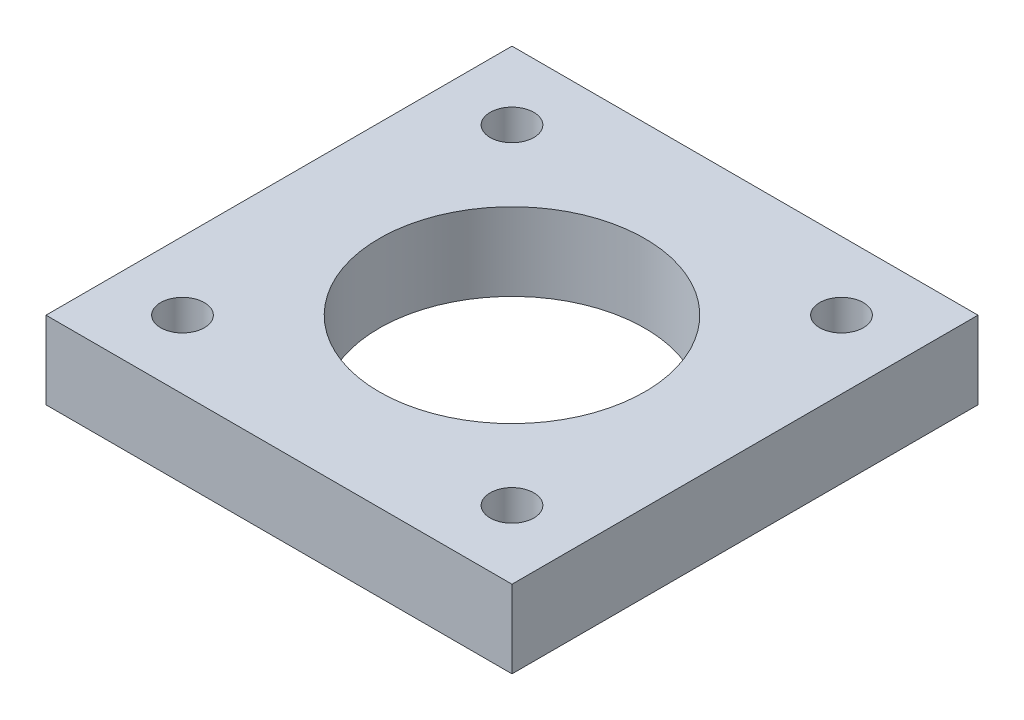
from build123d import *

# Parameters (mm, degrees)
SKETCH1_W      = 38.1
SKETCH1_H      = 38.1
SKETCH1_R      = 10.8585
SKETCH1_R_2    = 1.7859375
EXTRUDE1_DEPTH = 6.35


with BuildPart() as part:
    # Sketch1 → Extrude1 (new body)
    with BuildSketch(Plane(origin=(0, 0, 0), x_dir=(1, 0, 0), z_dir=(0, 1, 0))):
        with Locations((19.05, 19.05)):
            Rectangle(SKETCH1_W, SKETCH1_H)
        with Locations(Location((19.05, 19.05, 0), (0, 0, 270))):
            Circle(SKETCH1_R, mode=Mode.SUBTRACT)
        with Locations(Location((5.579615818, 32.520384182, 0), (0, 0, 270))):
            Circle(SKETCH1_R_2, mode=Mode.SUBTRACT)
        with Locations(Location((32.520384182, 32.520384182, 0), (0, 0, 270))):
            Circle(SKETCH1_R_2, mode=Mode.SUBTRACT)
        with Locations(Location((32.520384182, 5.579615818, 0), (0, 0, 270))):
            Circle(SKETCH1_R_2, mode=Mode.SUBTRACT)
        with Locations(Location((5.579615818, 5.579615818, 0), (0, 0, 270))):
            Circle(SKETCH1_R_2, mode=Mode.SUBTRACT)
    extrude(amount=EXTRUDE1_DEPTH)


solid = part.part
